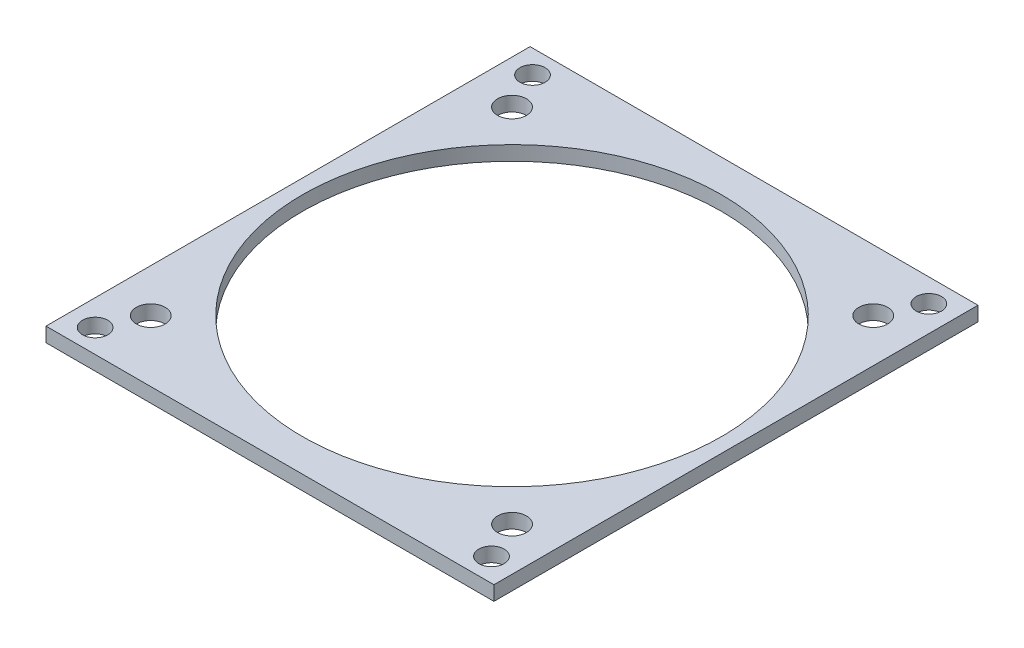
from build123d import *

# Parameters (mm, degrees)
SKETCH_1_W          = 62
SKETCH_1_H          = 67
SKETCH_1_R          = 2
EXTRUDE_1_DEPTH     = 2
SKETCH_4_R          = 29
CUT_EXTRUDE_2_DEPTH = 2
SKETCH_5_R          = 1.75
CUT_EXTRUDE_3_DEPTH = 2


with BuildPart() as part:
    # Эскиз1 → Бобышка-Вытянуть1 (new body)
    with BuildSketch(Plane(origin=(0, 0, 0), x_dir=(1, 0, 0), z_dir=(0, 1, 0))):
        Rectangle(SKETCH_1_W, SKETCH_1_H)
        with Locations(Location((25, 25, 0), (0, 0, 270))):
            Circle(SKETCH_1_R, mode=Mode.SUBTRACT)
        with Locations(Location((-25, 25, 0), (0, 0, 270))):
            Circle(SKETCH_1_R, mode=Mode.SUBTRACT)
        with Locations(Location((25, -25, 0), (0, 0, 270))):
            Circle(SKETCH_1_R, mode=Mode.SUBTRACT)
        with Locations(Location((-25, -25, 0), (0, 0, 270))):
            Circle(SKETCH_1_R, mode=Mode.SUBTRACT)
    extrude(amount=EXTRUDE_1_DEPTH)

    # Эскиз4 → Вырез-Вытянуть2 (cut)
    with BuildSketch(Plane.XZ):
        with Locations(Location((0, 0, 0), (0, 0, 270))):
            Circle(SKETCH_4_R)
    extrude(amount=-CUT_EXTRUDE_2_DEPTH, mode=Mode.SUBTRACT)

    # Эскиз5 → Вырез-Вытянуть3 (cut)
    with BuildSketch(Plane.XZ):
        with Locations(Location((-27.43, 30.27, 0), (0, 0, 270))):
            Circle(SKETCH_5_R)
        with Locations(Location((-27.43, -30.27, 0), (0, 0, 90))):
            Circle(SKETCH_5_R)
        with Locations(Location((27.43, -30.27, 0), (0, 0, 270))):
            Circle(SKETCH_5_R)
        with Locations(Location((27.43, 30.27, 0), (0, 0, 90))):
            Circle(SKETCH_5_R)
    extrude(amount=-CUT_EXTRUDE_3_DEPTH, mode=Mode.SUBTRACT)


solid = part.part
